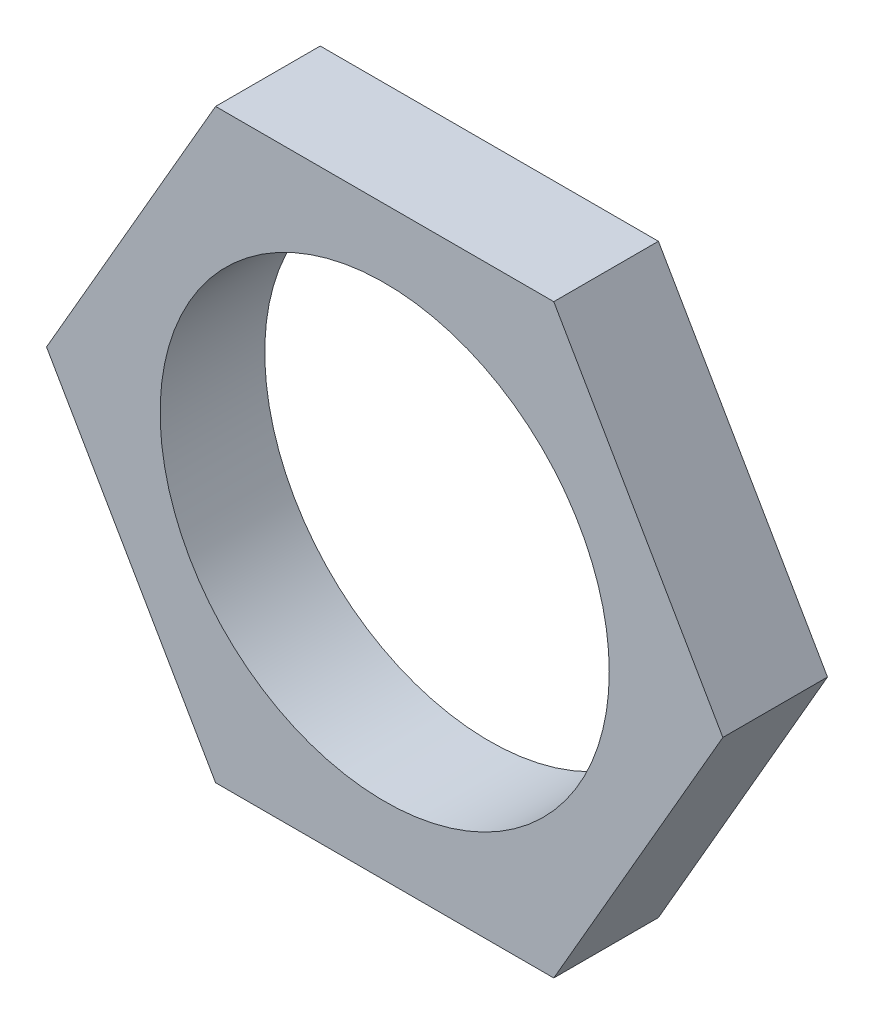
from build123d import *

# Parameters (mm, degrees)
SKETCH1_R           = 6.5151
BOSS_EXTRUDE1_DEPTH = 3.0353


with BuildPart() as part:
    # Sketch1 → Boss-Extrude1 (new body)
    with BuildSketch(Plane.XY):
        Polygon((4.905341092, 8.4963), (-4.905341092, 8.4963), (-9.810682184, 0), (-4.905341092, -8.4963), (4.905341092, -8.4963), (9.810682184, 0), align=None)
        Circle(SKETCH1_R, mode=Mode.SUBTRACT)
    extrude(amount=BOSS_EXTRUDE1_DEPTH)


solid = part.part
